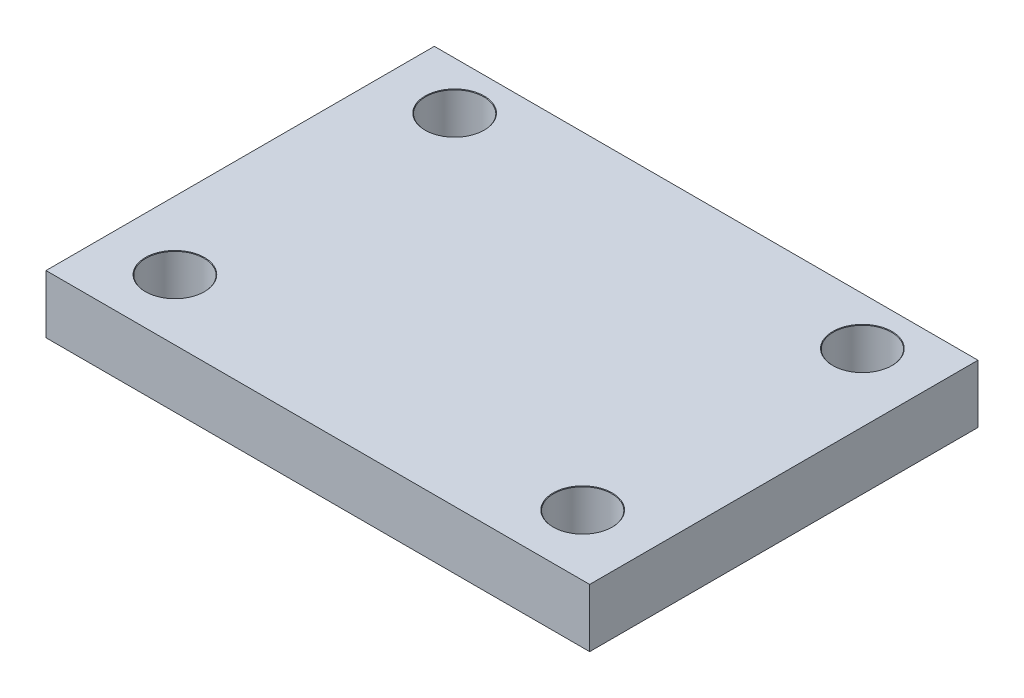
from build123d import *

# Parameters (mm, degrees)
SKETCH1_W                          = 28
SKETCH1_H                          = 20
BOSS_EXTRUDE1_DEPTH                = 3
F_3_0_3_DIAMETER_HOLE7_D           = 3
F_3_0_3_DIAMETER_HOLE7_DEPTH       = 3
F_3_0_3_DIAMETER_HOLE7_CSINK_D     = 3.05
F_3_0_3_DIAMETER_HOLE7_CSINK_ANGLE = 90
F_3_0_3_DIAMETER_HOLE7_TIP         = 0.901290929


with BuildPart() as part:
    # Sketch1 → Boss-Extrude1 (new body)
    with BuildSketch(Plane(origin=(0, 0, 0), x_dir=(1, 0, 0), z_dir=(0, 1, 0))):
        Rectangle(SKETCH1_W, SKETCH1_H)
    extrude(amount=-BOSS_EXTRUDE1_DEPTH)

    # Ø3.0 (3) Diameter Hole7
    with Locations(Plane(origin=(0, 0, 0), x_dir=(1, 0, 0), z_dir=(0, 1, 0))):
        with Locations((-10.5, 7.545553469), (10.5, 7.545553469), (10.5, -6.860504487), (-10.5, -6.860504487)):
            CounterSinkHole(F_3_0_3_DIAMETER_HOLE7_D / 2, F_3_0_3_DIAMETER_HOLE7_CSINK_D / 2, depth=F_3_0_3_DIAMETER_HOLE7_DEPTH, counter_sink_angle=F_3_0_3_DIAMETER_HOLE7_CSINK_ANGLE)
            with Locations((0, 0, -(F_3_0_3_DIAMETER_HOLE7_DEPTH + F_3_0_3_DIAMETER_HOLE7_TIP / 2))):  # 118° drill point
                Cone(0, F_3_0_3_DIAMETER_HOLE7_D / 2, F_3_0_3_DIAMETER_HOLE7_TIP, mode=Mode.SUBTRACT)


solid = part.part
